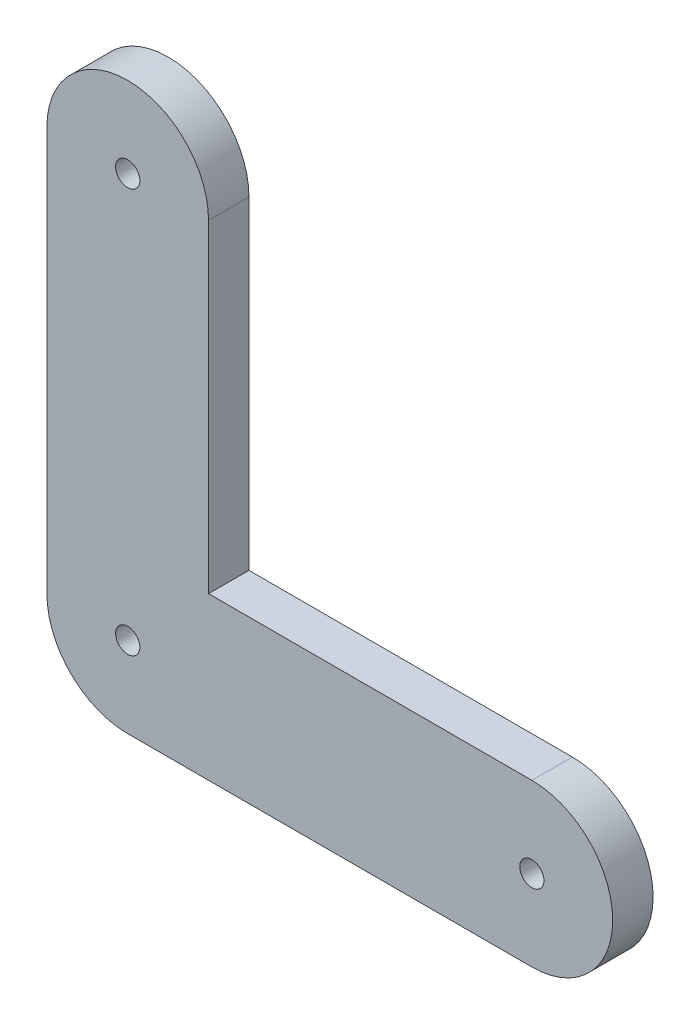
from build123d import *

# Parameters (mm, degrees)
SKETCH2_R           = 1.5
BOSS_EXTRUDE1_DEPTH = 5


with BuildPart() as part:
    # Sketch2 → Boss-Extrude1 (new body)
    with BuildSketch(Plane.XY):
        with BuildLine():
            Line((-10, 50), (-10, 0))
            ThreePointArc((-10, 0), (-7.071067812, -7.071067812), (0, -10))
            Line((0, -10), (50, -10))
            ThreePointArc((50, -10), (60, 0), (50, 10))
            Line((50, 10), (10, 10))
            Line((10, 10), (10, 50))
            ThreePointArc((10, 50), (0, 60), (-10, 50))
        make_face()
        Circle(SKETCH2_R, mode=Mode.SUBTRACT)
        with Locations((0, 50)):
            Circle(SKETCH2_R, mode=Mode.SUBTRACT)
        with Locations((50, 0)):
            Circle(SKETCH2_R, mode=Mode.SUBTRACT)
    extrude(amount=BOSS_EXTRUDE1_DEPTH)


solid = part.part
